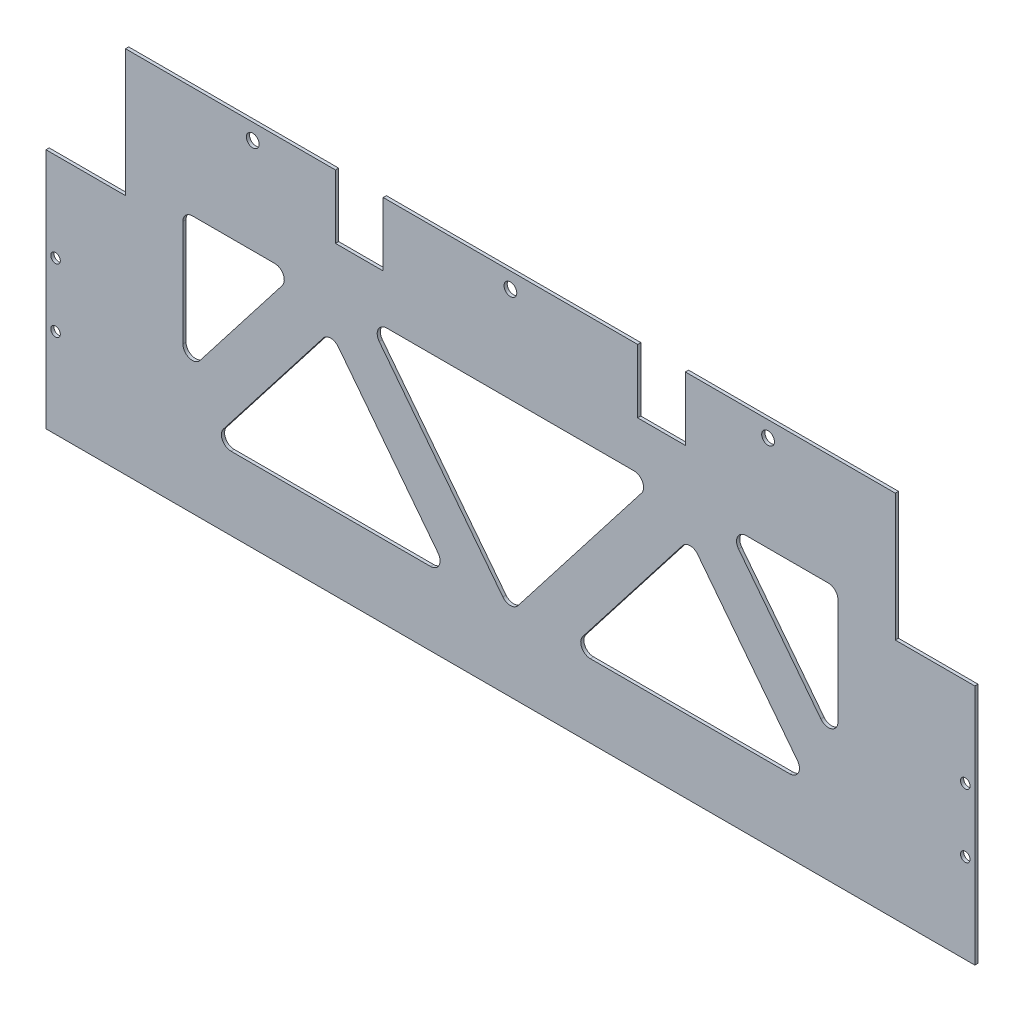
from build123d import *

# Parameters (mm, degrees)
SKETCH_1_R          = 1.5
EXTRUDE_1_DEPTH     = 1
SKETCH_2_R          = 2
SKETCH_2_W          = 15
SKETCH_2_H          = 20
CUT_EXTRUDE_1_DEPTH = 315.198981539
CUT_EXTRUDE_2_REACH = 316.199
FILLET_1_R          = 3


with BuildPart() as part:
    # 草图1 → 凸台-拉伸1 (new body)
    with BuildSketch(Plane.XY):
        Polygon((0, 0), (0, 76), (25, 76), (25, 116), (267, 116), (267, 76), (292, 76), (292, 0), align=None)
        with Locations((3, 48)):
            Circle(SKETCH_1_R, mode=Mode.SUBTRACT)
        with Locations((3, 28)):
            Circle(SKETCH_1_R, mode=Mode.SUBTRACT)
        with Locations(Location((289, 28, 0), (0, 0, 180))):
            Circle(SKETCH_1_R, mode=Mode.SUBTRACT)
        with Locations(Location((289, 48, 0), (0, 0, 180))):
            Circle(SKETCH_1_R, mode=Mode.SUBTRACT)
    extrude(amount=EXTRUDE_1_DEPTH)

    # 草图2 → 切除-拉伸1 (cut, through all)
    with BuildSketch(Plane.XY.offset(1)):
        with Locations((65, 111)):
            Circle(SKETCH_2_R)
        with Locations(Location((227, 111, 0), (0, 0, 180))):
            Circle(SKETCH_2_R)
        with Locations((146, 111)):
            Circle(SKETCH_2_R)
        with Locations((193.5, 106)):
            Rectangle(SKETCH_2_W, SKETCH_2_H)
        with Locations((98.5, 106)):
            Rectangle(SKETCH_2_W, SKETCH_2_H)
    extrude(amount=-CUT_EXTRUDE_1_DEPTH, mode=Mode.SUBTRACT)

    # 草图3 → 切除-拉伸2 (cut, up to next)
    with BuildSketch(Plane(origin=(0, 0, 0), x_dir=(-1, 0, 0), z_dir=(0, 0, -1)), mode=Mode.PRIVATE) as cut_extrude_2_sk1:
        Polygon((-43.02940934, 35.888888889), (-78.02940934, 81), (-43.02940934, 81), align=None)
    cut_extrude_2_tool1 = extrude(cut_extrude_2_sk1.sketch, amount=-CUT_EXTRUDE_2_REACH, mode=Mode.PRIVATE) & part.part
    # 草图3 → 切除-拉伸2 (cut, up to next)
    with BuildSketch(Plane(origin=(0, 0, 0), x_dir=(-1, 0, 0), z_dir=(0, 0, -1)), mode=Mode.PRIVATE) as cut_extrude_2_sk2:
        Polygon((-127.01470467, 23), (-52.01470467, 23), (-89.51470467, 71.333333333), align=None)
    cut_extrude_2_tool2 = extrude(cut_extrude_2_sk2.sketch, amount=-CUT_EXTRUDE_2_REACH, mode=Mode.PRIVATE) & part.part
    # 草图3 → 切除-拉伸2 (cut, up to next)
    with BuildSketch(Plane(origin=(0, 0, 0), x_dir=(-1, 0, 0), z_dir=(0, 0, -1)), mode=Mode.PRIVATE) as cut_extrude_2_sk3:
        Polygon((-101, 81), (-146, 81), (-146, 23), align=None)
    cut_extrude_2_tool3 = extrude(cut_extrude_2_sk3.sketch, amount=-CUT_EXTRUDE_2_REACH, mode=Mode.PRIVATE) & part.part
    # 草图3 → 切除-拉伸2 (cut, up to next)
    with BuildSketch(Plane(origin=(0, 0, 0), x_dir=(-1, 0, 0), z_dir=(0, 0, -1)), mode=Mode.PRIVATE) as cut_extrude_2_sk4:
        Polygon((-202.48529533, 71.333333333), (-164.98529533, 23), (-239.98529533, 23), align=None)
    cut_extrude_2_tool4 = extrude(cut_extrude_2_sk4.sketch, amount=-CUT_EXTRUDE_2_REACH, mode=Mode.PRIVATE) & part.part
    # 草图3 → 切除-拉伸2 (cut, up to next)
    with BuildSketch(Plane(origin=(0, 0, 0), x_dir=(-1, 0, 0), z_dir=(0, 0, -1)), mode=Mode.PRIVATE) as cut_extrude_2_sk5:
        Polygon((-146, 81), (-191, 81), (-146, 23), align=None)
    cut_extrude_2_tool5 = extrude(cut_extrude_2_sk5.sketch, amount=-CUT_EXTRUDE_2_REACH, mode=Mode.PRIVATE) & part.part
    # 草图3 → 切除-拉伸2 (cut, up to next)
    with BuildSketch(Plane(origin=(0, 0, 0), x_dir=(-1, 0, 0), z_dir=(0, 0, -1)), mode=Mode.PRIVATE) as cut_extrude_2_sk6:
        Polygon((-248.97059066, 35.888888889), (-213.97059066, 81), (-248.97059066, 81), align=None)
    cut_extrude_2_tool6 = extrude(cut_extrude_2_sk6.sketch, amount=-CUT_EXTRUDE_2_REACH, mode=Mode.PRIVATE) & part.part
    add(cut_extrude_2_tool1.solids().sort_by_distance((54.696076, 65.962963, 0))[0], mode=Mode.SUBTRACT)
    add(cut_extrude_2_tool2.solids().sort_by_distance((89.514705, 39.111111, 0))[0], mode=Mode.SUBTRACT)
    add(cut_extrude_2_tool3.solids().sort_by_distance((131, 61.666667, 0))[0], mode=Mode.SUBTRACT)
    add(cut_extrude_2_tool4.solids().sort_by_distance((202.485295, 39.111111, 0))[0], mode=Mode.SUBTRACT)
    add(cut_extrude_2_tool5.solids().sort_by_distance((161, 61.666667, 0))[0], mode=Mode.SUBTRACT)
    add(cut_extrude_2_tool6.solids().sort_by_distance((237.303924, 65.962963, 0))[0], mode=Mode.SUBTRACT)

    # 圆角1
    fillet_1_edges = [part.edges().sort_by_distance(p)[0] for p in [
        (52.01470467, 23, 0.5),
        (127.01470467, 23, 0.5),
        (89.51470467, 71.333333333, 0.5),
        (202.48529533, 71.333333333, 0.5),
        (164.98529533, 23, 0.5),
        (239.98529533, 23, 0.5),
        (191, 81, 0.5),
        (101, 81, 0.5),
        (146, 23, 0.5),
        (213.97059066, 81, 0.5),
        (248.97059066, 35.888888889, 0.5),
        (248.97059066, 81, 0.5),
        (43.02940934, 35.888888889, 0.5),
        (78.02940934, 81, 0.5),
        (43.02940934, 81, 0.5),
    ]]
    fillet(fillet_1_edges, radius=FILLET_1_R)


solid = part.part
